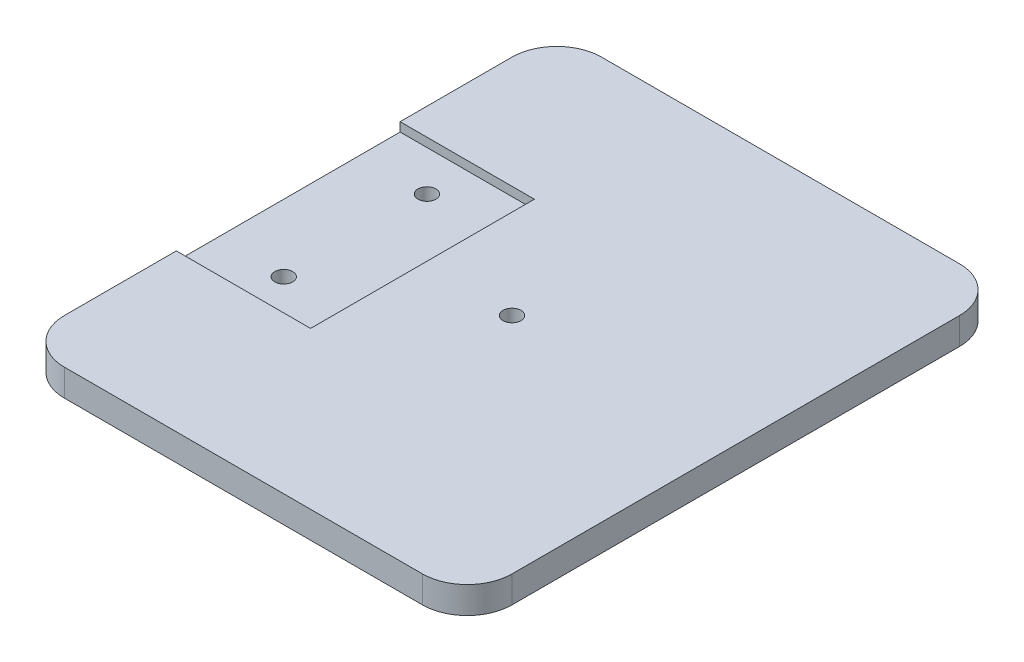
from build123d import *

# Parameters (mm, degrees)
BOSS_EXTRUDE1_DEPTH = 3
SKETCH2_W           = 15
SKETCH2_H           = 25
CUT_EXTRUDE1_DEPTH  = 1
SKETCH3_R           = 1
CUT_EXTRUDE2_DEPTH  = 2
SKETCH4_R           = 1
CUT_EXTRUDE3_DEPTH  = 3


with BuildPart() as part:
    # Sketch1 → Boss-Extrude1 (new body)
    with BuildSketch(Plane(origin=(0, 0, 0), x_dir=(1, 0, 0), z_dir=(0, 1, 0))):
        with BuildLine():
            Line((-31.037917644, 28.304049085), (8.962082356, 28.304049085))
            ThreePointArc((8.962082356, 28.304049085), (12.497616262, 26.839582991), (13.962082356, 23.304049085))
            Line((13.962082356, 23.304049085), (13.962082356, -26.695950915))
            ThreePointArc((13.962082356, -26.695950915), (12.497616262, -30.23148482), (8.962082356, -31.695950915))
            Line((8.962082356, -31.695950915), (-31.037917644, -31.695950915))
            ThreePointArc((-31.037917644, -31.695950915), (-34.57345155, -30.23148482), (-36.037917644, -26.695950915))
            Line((-36.037917644, -26.695950915), (-36.037917644, 23.304049085))
            ThreePointArc((-36.037917644, 23.304049085), (-34.57345155, 26.839582991), (-31.037917644, 28.304049085))
        make_face()
    extrude(amount=BOSS_EXTRUDE1_DEPTH)

    # Sketch2 → Cut-Extrude1 (cut)
    with BuildSketch(Plane(origin=(0, 3, 0), x_dir=(1, 0, 0), z_dir=(0, 1, 0))):
        with Locations((-28.537917644, -1.695950915)):
            Rectangle(SKETCH2_W, SKETCH2_H)
    extrude(amount=-CUT_EXTRUDE1_DEPTH, mode=Mode.SUBTRACT)

    # Sketch3 → Cut-Extrude2 (cut)
    with BuildSketch(Plane(origin=(0, 2, 0), x_dir=(1, 0, 0), z_dir=(0, 1, 0))):
        with Locations(Location((-28.537917644, 6.304049085, 0), (0, 0, 270))):
            Circle(SKETCH3_R)
        with Locations(Location((-28.537917644, -9.695950915, 0), (0, 0, 270))):
            Circle(SKETCH3_R)
    extrude(amount=-CUT_EXTRUDE2_DEPTH, mode=Mode.SUBTRACT)

    # Sketch4 → Cut-Extrude3 (cut)
    with BuildSketch(Plane(origin=(0, 3, 0), x_dir=(1, 0, 0), z_dir=(0, 1, 0))):
        with Locations(Location((-11.037917644, -1.695950915, 0), (0, 0, 270))):
            Circle(SKETCH4_R)
    extrude(amount=-CUT_EXTRUDE3_DEPTH, mode=Mode.SUBTRACT)


solid = part.part
